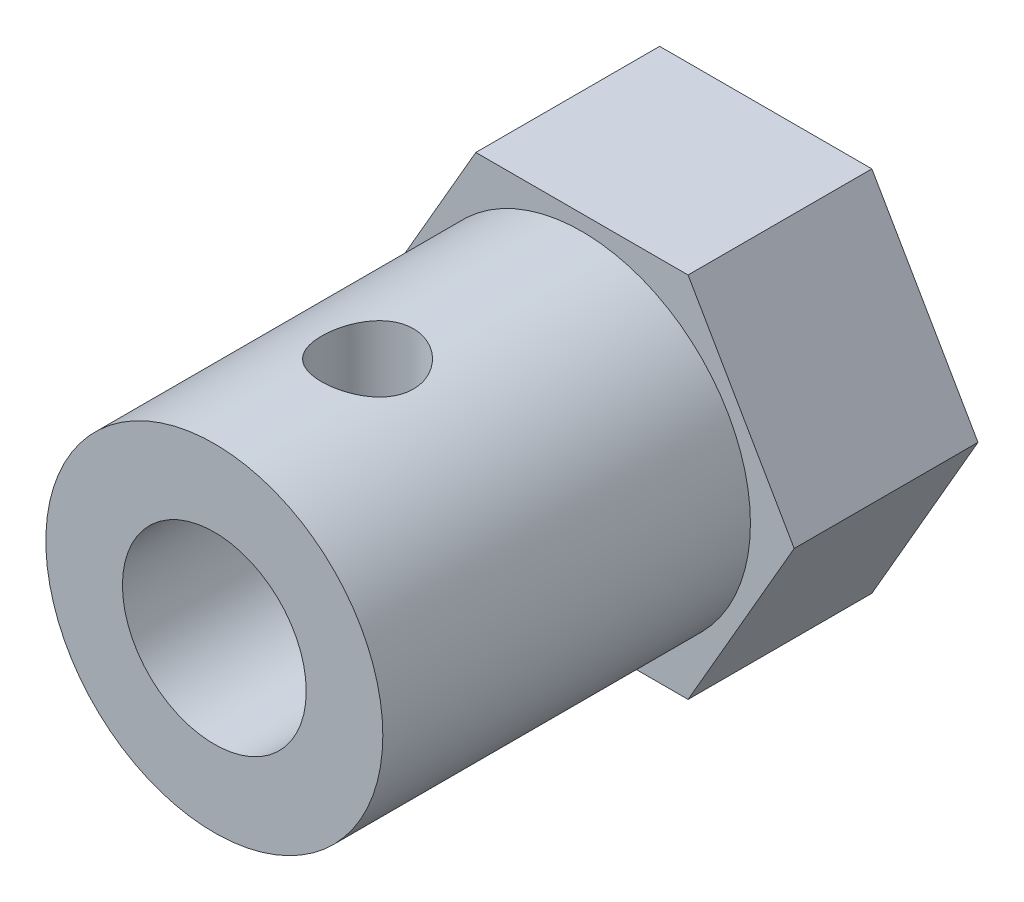
from build123d import *

# Parameters (mm, degrees)
EXTRUDE_1_DEPTH     = 6
SKETCH_2_R          = 5.5
EXTRUDE_2_DEPTH     = 12
SKETCH_3_R          = 3
CUT_EXTRUDE_1_DEPTH = 13
SKETCH_4_R          = 2
CUT_EXTRUDE_2_DEPTH = 5
SKETCH_5_R          = 1.5
CUT_EXTRUDE_3_DEPTH = 12


with BuildPart() as part:
    # 草图1 → 凸台-拉伸1 (new body)
    with BuildSketch(Plane.XY):
        Polygon((6.92820323, 0), (3.464101615, 6), (-3.464101615, 6), (-6.92820323, 0), (-3.464101615, -6), (3.464101615, -6), align=None)
    extrude(amount=EXTRUDE_1_DEPTH)

    # 草图2 → 凸台-拉伸2 (add)
    with BuildSketch(Plane.XY.offset(6)):
        Circle(SKETCH_2_R)
    extrude(amount=EXTRUDE_2_DEPTH)

    # 草图3 → 切除-拉伸1 (cut)
    with BuildSketch(Plane.XY.offset(18)):
        Circle(SKETCH_3_R)
    extrude(amount=-CUT_EXTRUDE_1_DEPTH, mode=Mode.SUBTRACT)

    # 草图4 → 切除-拉伸2 (cut)
    with BuildSketch(Plane(origin=(0, 0, 0), x_dir=(-1, 0, 0), z_dir=(0, 0, -1))):
        Circle(SKETCH_4_R)
    extrude(amount=-CUT_EXTRUDE_2_DEPTH, mode=Mode.SUBTRACT)

    # 草图5 → 切除-拉伸3 (cut)
    with BuildSketch(Plane(origin=(0, 0, 0), x_dir=(1, 0, 0), z_dir=(0, 1, 0))):
        with Locations(Location((0, -13, 0), (0, 0, 90))):
            Circle(SKETCH_5_R)
    extrude(amount=CUT_EXTRUDE_3_DEPTH, mode=Mode.SUBTRACT)


solid = part.part
